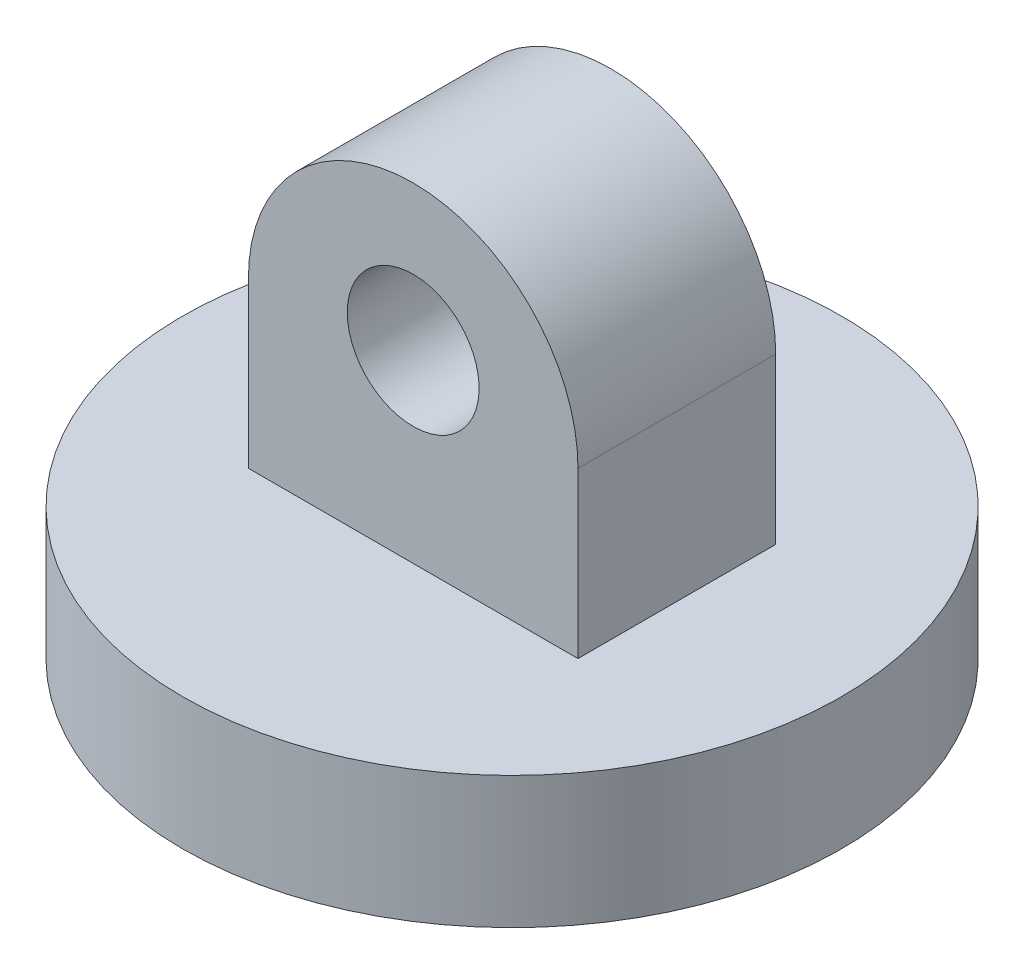
from build123d import *

# Parameters (mm, degrees)
CROQUIS1_R              = 50
SALIENTE_EXTRUIR1_DEPTH = 20
CROQUIS2_W              = 50
CROQUIS2_H              = 30
SALIENTE_EXTRUIR2_DEPTH = 50
CROQUIS3_R              = 10
CORTAR_EXTRUIR1_DEPTH   = 30
REDONDEO1_RADIUS        = 25
REDONDEO1_LENGTH        = 30


with BuildPart() as part:
    # Croquis1 → Saliente-Extruir1 (new body)
    with BuildSketch(Plane(origin=(0, 0, 0), x_dir=(1, 0, 0), z_dir=(0, 1, 0))):
        with Locations(Location((0, 0, 0), (0, 0, 270))):
            Circle(CROQUIS1_R)
    extrude(amount=SALIENTE_EXTRUIR1_DEPTH)

    # Croquis2 → Saliente-Extruir2 (add)
    with BuildSketch(Plane(origin=(0, 20, 0), x_dir=(1, 0, 0), z_dir=(0, 1, 0))):
        Rectangle(CROQUIS2_W, CROQUIS2_H)
    extrude(amount=SALIENTE_EXTRUIR2_DEPTH)

    # Croquis3 → Cortar-Extruir1 (cut)
    with BuildSketch(Plane(origin=(0, 0, -15), x_dir=(-1, 0, 0), z_dir=(0, 0, -1))):
        with Locations((0, 48)):
            Circle(CROQUIS3_R)
    extrude(amount=-CORTAR_EXTRUIR1_DEPTH, mode=Mode.SUBTRACT)

    # Redondeo1: full round fillet: the end face becomes a half cylinder, R = half its width
    redondeo1_face = Plane((0, 70, 0), x_dir=(0, 0, 1), z_dir=(0, 1, 0))  # on the end face: x along it, z out of the body
    redondeo1_slab = redondeo1_face.offset(-REDONDEO1_RADIUS / 2) * Box(REDONDEO1_LENGTH, 2 * REDONDEO1_RADIUS, REDONDEO1_RADIUS, mode=Mode.PRIVATE)  # the body's end, R deep
    redondeo1_round = Plane((0, 45, 0), x_dir=(0, 1, 0), z_dir=(0, 0, 1)) * Cylinder(REDONDEO1_RADIUS, REDONDEO1_LENGTH, mode=Mode.PRIVATE)  # its axis R under the face
    add(redondeo1_slab - redondeo1_round, mode=Mode.SUBTRACT)


solid = part.part
